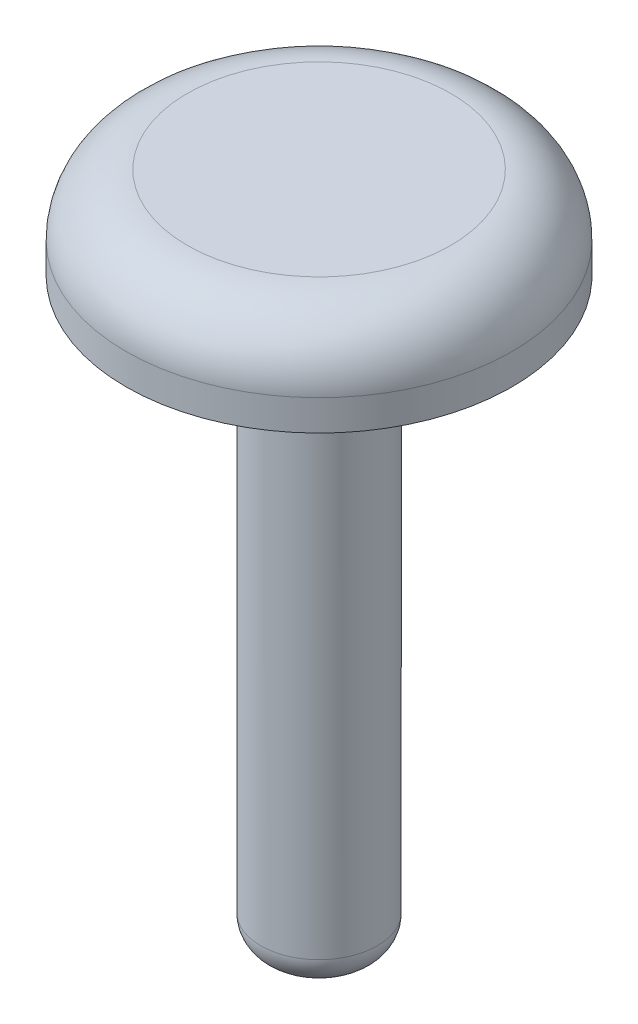
from build123d import *
from build123d.topology import SkipClean

# Parameters (mm, degrees)
CROQUIS1_R                   = 0.95
SALIENTE_EXTRUIR1_DEPTH      = 11
SALIENTE_EXTRUIR2_DEPTH      = 0.0001
SALIENTE_EXTRUIR2_DEPTH_BACK = 1.5
CROQUIS2_R                   = 3.15
REDONDEO3_R                  = 0.5
REDONDEO5_R                  = 1
CROQUIS4_R                   = 2.65
CROQUIS4_R_2                 = 0.95
CORTAR_EXTRUIR4_DEPTH        = 1


with BuildPart() as part:
    # Croquis1 → Saliente-Extruir1 (new body)
    with BuildSketch(Plane(origin=(0, 0, 0), x_dir=(1, 0, 0), z_dir=(0, 1, 0))):
        with Locations(Location((0, 0, 0), (0, 0, 270))):
            Circle(CROQUIS1_R)
    extrude(amount=SALIENTE_EXTRUIR1_DEPTH)

    # Croquis2 → Saliente-Extruir2 (add, two sides: drawn at the far end of the back side and taken through both)
    with BuildSketch(Plane(origin=(0, 11, 0), x_dir=(1, 0, 0), z_dir=(0, 1, 0)).offset(-SALIENTE_EXTRUIR2_DEPTH_BACK)):
        with Locations(Location((0, 0, 0), (0, 0, 270))):
            Circle(CROQUIS2_R)
    extrude(amount=SALIENTE_EXTRUIR2_DEPTH + SALIENTE_EXTRUIR2_DEPTH_BACK)

    # Redondeo3
    redondeo3_edges = [part.edges().sort_by_distance(p)[0] for p in [
        (0, 0, -0.95),
    ]]
    fillet(redondeo3_edges, radius=REDONDEO3_R)

    # Redondeo5
    redondeo5_edges = [part.edges().sort_by_distance(p)[0] for p in [
        (0, 11.0001, -3.15),
    ]]
    fillet(redondeo5_edges, radius=REDONDEO5_R)

    # Croquis4 → Cortar-Extruir4 (cut)
    with SkipClean():  # the faces are left unmerged after this step: merging them gives an invalid solid
        with BuildSketch(Plane(origin=(0, 9.5, 0), x_dir=(-1, 0, 0), z_dir=(0, -1, 0))):
            with Locations(Location((0, 0, 0), (0, 0, 90))):
                Circle(CROQUIS4_R)
            with Locations(Location((0, 0, 0), (0, 0, 90))):
                Circle(CROQUIS4_R_2, mode=Mode.SUBTRACT)
        extrude(amount=-CORTAR_EXTRUIR4_DEPTH, mode=Mode.SUBTRACT)


solid = part.part
